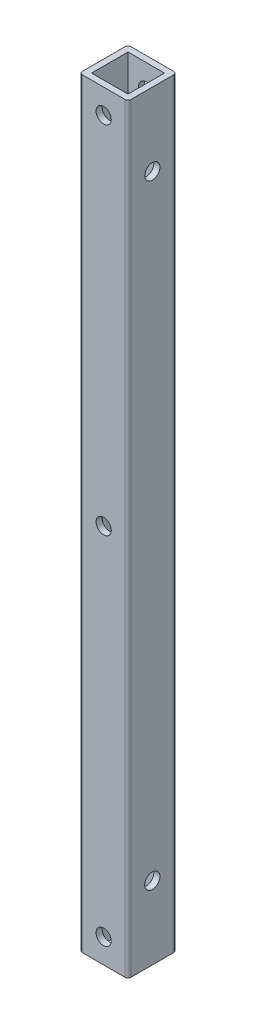
from build123d import *

# Parameters (mm, degrees)
SKETCH1_W           = 16
SKETCH1_H           = 16
SKETCH1_W_2         = 12
SKETCH1_H_2         = 12
BOSS_EXTRUDE1_DEPTH = 250
FILLET1_R           = 1
SKETCH2_R           = 2.5
CUT_EXTRUDE1_DEPTH  = 16
SKETCH3_R           = 2.5
CUT_EXTRUDE2_DEPTH  = 16
SKETCH4_R           = 2.5
CUT_EXTRUDE3_DEPTH  = 16
SKETCH5_R           = 2.5
CUT_EXTRUDE4_DEPTH  = 16


with BuildPart() as part:
    # Sketch1 → Boss-Extrude1 (new body)
    with BuildSketch(Plane(origin=(0, 0, 0), x_dir=(1, 0, 0), z_dir=(0, 1, 0))):
        with Locations((-0.059056614, 0.224719101)):
            Rectangle(SKETCH1_W, SKETCH1_H)
        with Locations((-0.059056614, 0.224719101)):
            Rectangle(SKETCH1_W_2, SKETCH1_H_2, mode=Mode.SUBTRACT)
    extrude(amount=BOSS_EXTRUDE1_DEPTH)

    # Fillet1
    fillet1_edges = [part.edges().sort_by_distance(p)[0] for p in [
        (-8.059056614, 125, -8.224719101),
        (7.940943386, 125, -8.224719101),
        (7.940943386, 125, 7.775280899),
        (-8.059056614, 125, 7.775280899),
    ]]
    fillet(fillet1_edges, radius=FILLET1_R)

    # Sketch2 → Cut-Extrude1 (cut)
    with BuildSketch(Plane.XY.offset(7.775280899)):
        with Locations((-0.059056614, 8)):
            Circle(SKETCH2_R)
    extrude(amount=-CUT_EXTRUDE1_DEPTH, mode=Mode.SUBTRACT)

    # Sketch3 → Cut-Extrude2 (cut)
    with BuildSketch(Plane.XY.offset(7.775280899)):
        with Locations((-0.059056614, 242)):
            Circle(SKETCH3_R)
    extrude(amount=-CUT_EXTRUDE2_DEPTH, mode=Mode.SUBTRACT)

    # Sketch4 → Cut-Extrude3 (cut)
    with BuildSketch(Plane.ZY.offset(8.059056614)):
        with Locations((-0.224719101, 24)):
            Circle(SKETCH4_R)
        with Locations((-0.224719101, 226)):
            Circle(SKETCH4_R)
    extrude(amount=-CUT_EXTRUDE3_DEPTH, mode=Mode.SUBTRACT)

    # Sketch5 → Cut-Extrude4 (cut)
    with BuildSketch(Plane.XY.offset(7.775280899)):
        with Locations((-0.059056614, 125)):
            Circle(SKETCH5_R)
    extrude(amount=-CUT_EXTRUDE4_DEPTH, mode=Mode.SUBTRACT)


solid = part.part
